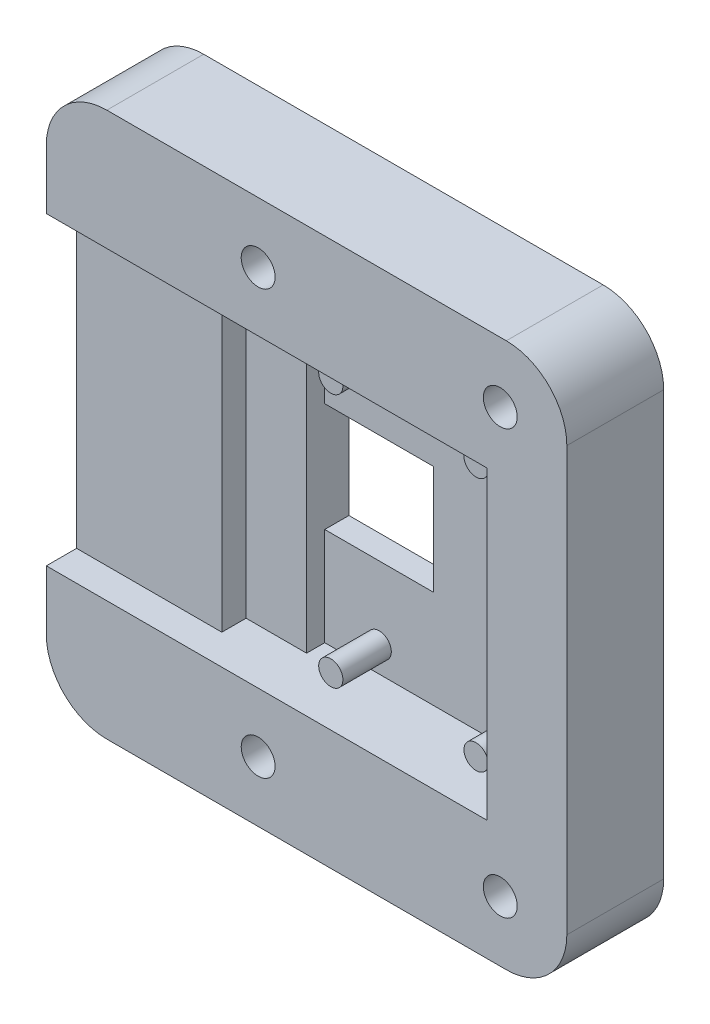
from build123d import *

# Parameters (mm, degrees)
SKETCH_1_R          = 1
SKETCH_1_W          = 9
SKETCH_1_H          = 9
EXTRUDE_1_DEPTH     = 2
SKETCH_3_W          = 17
SKETCH_3_H          = 45
EXTRUDE_3_DEPTH     = 1.5
EXTRUDE_4_DEPTH     = 6
SKETCH_1_3_R        = 1
EXTRUDE_5_DEPTH     = 6
SKETCH_6_R          = 1.4
CUT_EXTRUDE_1_DEPTH = 37.421147703
CHAMFER_1_SIZE      = 2
SKETCH_7_W          = 12
SKETCH_7_H          = 25.2
EXTRUDE_6_DEPTH     = 2
FILLET_1_R          = 5


with BuildPart() as part:
    # 스케치1 → 보스-돌출1 (new body)
    with BuildSketch(Plane.XY):
        Polygon((15.5, 22.5), (-15.5, 22.5), (-27.5, 22.5), (-27.5, -22.5), (-15.5, -22.5), (15.5, -22.5), align=None)
        with Locations((-6, -10.5)):
            Circle(SKETCH_1_R, mode=Mode.SUBTRACT)
        with Locations((-6, 0)):
            Rectangle(SKETCH_1_W, SKETCH_1_H, mode=Mode.SUBTRACT)
        with Locations((6, -10.5)):
            Circle(SKETCH_1_R, mode=Mode.SUBTRACT)
        with Locations((-6, 10.5)):
            Circle(SKETCH_1_R, mode=Mode.SUBTRACT)
        with Locations((6, 10.5)):
            Circle(SKETCH_1_R, mode=Mode.SUBTRACT)
    extrude(amount=EXTRUDE_1_DEPTH)

    # 스케치3 → 보스-돌출3 (add)
    with BuildSketch(Plane.XY.offset(2)):
        with Locations((-19, 0)):
            Rectangle(SKETCH_3_W, SKETCH_3_H)
    extrude(amount=EXTRUDE_3_DEPTH)

    # 스케치4 → 보스-돌출4 (add)
    with BuildSketch(Plane.XY.offset(2)):
        Polygon((-15.5, -22.5), (15.5, -22.5), (15.5, 22.5), (-15.5, 22.5), (-27.5, 22.5), (-27.5, 12.6), (-15.5, 12.6), (8.9, 12.6), (8.9, -12.6), (-15.5, -12.6), (-27.5, -12.6), (-27.5, -22.5), align=None)
    extrude(amount=EXTRUDE_4_DEPTH)

    # 스케치1<3> → 보스-돌출5 (add)
    with BuildSketch(Plane.XY):
        with Locations((-6, 10.5)):
            Circle(SKETCH_1_3_R)
        with Locations((6, 10.5)):
            Circle(SKETCH_1_3_R)
        with Locations((6, -10.5)):
            Circle(SKETCH_1_3_R)
        with Locations((-6, -10.5)):
            Circle(SKETCH_1_3_R)
    extrude(amount=EXTRUDE_5_DEPTH)

    # 스케치6 → 컷-돌출1 (cut, through all)
    with BuildSketch(Plane.XY):
        with Locations((-10, 17.5)):
            Circle(SKETCH_6_R)
        with Locations((10, 17.5)):
            Circle(SKETCH_6_R)
        with Locations((10, -17.5)):
            Circle(SKETCH_6_R)
        with Locations((-10, -17.5)):
            Circle(SKETCH_6_R)
    extrude(amount=CUT_EXTRUDE_1_DEPTH, mode=Mode.SUBTRACT)

    # 모따기1
    chamfer_1_edges = [part.edges().sort_by_distance(p)[0] for p in [
        (8.6, 17.5, 0),
        (-11.4, 17.5, 0),
        (-11.4, -17.5, 0),
        (8.6, -17.5, 0),
    ]]
    chamfer(chamfer_1_edges, length=CHAMFER_1_SIZE)

    # 스케치7 → 보스-돌출6 (add)
    with BuildSketch(Plane.XY.offset(3.5)):
        with Locations((-21.5, 0)):
            Rectangle(SKETCH_7_W, SKETCH_7_H)
    extrude(amount=EXTRUDE_6_DEPTH)

    # 필렛1
    fillet_1_edges = [part.edges().sort_by_distance(p)[0] for p in [
        (15.5, -22.5, 4),
        (15.5, 22.5, 4),
        (-27.5, 22.5, 4),
        (-27.5, -22.5, 4),
    ]]
    fillet(fillet_1_edges, radius=FILLET_1_R)


solid = part.part
